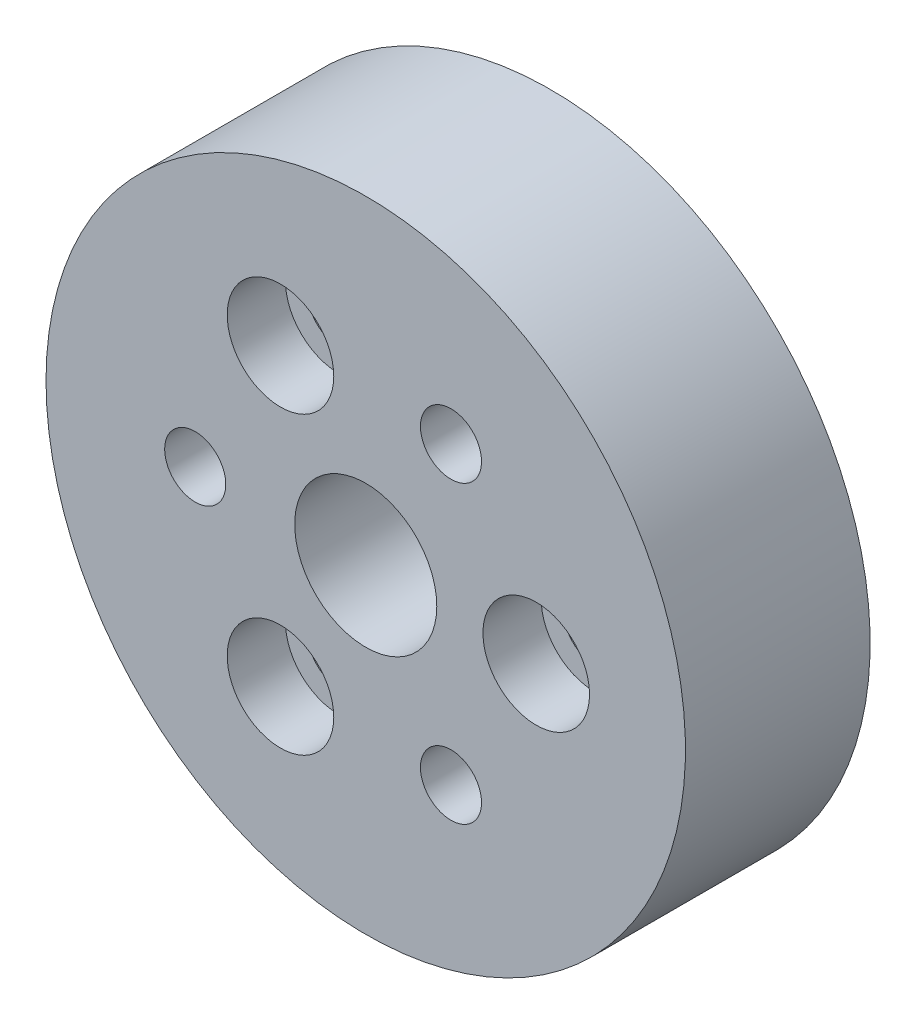
from build123d import *

# Parameters (mm, degrees)
SKETCH2_R           = 22.5
SKETCH2_R_2         = 2.15
BOSS_EXTRUDE1_DEPTH = 13
SKETCH3_R           = 3.75
CUT_EXTRUDE1_DEPTH  = 4.1
SKETCH5_R           = 5
CUT_EXTRUDE3_DEPTH  = 35.372954485


with BuildPart() as part:
    # Sketch2 → Boss-Extrude1 (new body)
    with BuildSketch(Plane.XY):
        with Locations(Location((0, 0, 0), (0, 0, 180))):
            Circle(SKETCH2_R)
        with Locations(Location((12, 0, 0), (0, 0, 180))):
            Circle(SKETCH2_R_2, mode=Mode.SUBTRACT)
        with Locations(Location((6, -10.392304845, 0), (0, 0, 180))):
            Circle(SKETCH2_R_2, mode=Mode.SUBTRACT)
        with Locations(Location((-6, -10.392304845, 0), (0, 0, 180))):
            Circle(SKETCH2_R_2, mode=Mode.SUBTRACT)
        with Locations(Location((-12, 0, 0), (0, 0, 180))):
            Circle(SKETCH2_R_2, mode=Mode.SUBTRACT)
        with Locations(Location((-6, 10.392304845, 0), (0, 0, 180))):
            Circle(SKETCH2_R_2, mode=Mode.SUBTRACT)
        with Locations(Location((6, 10.392304845, 0), (0, 0, 180))):
            Circle(SKETCH2_R_2, mode=Mode.SUBTRACT)
    extrude(amount=BOSS_EXTRUDE1_DEPTH)

    # Sketch3 → Cut-Extrude1 (cut)
    with BuildSketch(Plane.XY.offset(13)):
        with Locations((-6, 10.392304845)):
            Circle(SKETCH3_R)
        with Locations((-6, -10.392304845)):
            Circle(SKETCH3_R)
        with Locations((12, 0)):
            Circle(SKETCH3_R)
    extrude(amount=-CUT_EXTRUDE1_DEPTH, mode=Mode.SUBTRACT)

    # Sketch5 → Cut-Extrude3 (cut, through all)
    with BuildSketch(Plane.XY.offset(13)):
        Circle(SKETCH5_R)
    extrude(amount=-CUT_EXTRUDE3_DEPTH, mode=Mode.SUBTRACT)


solid = part.part
